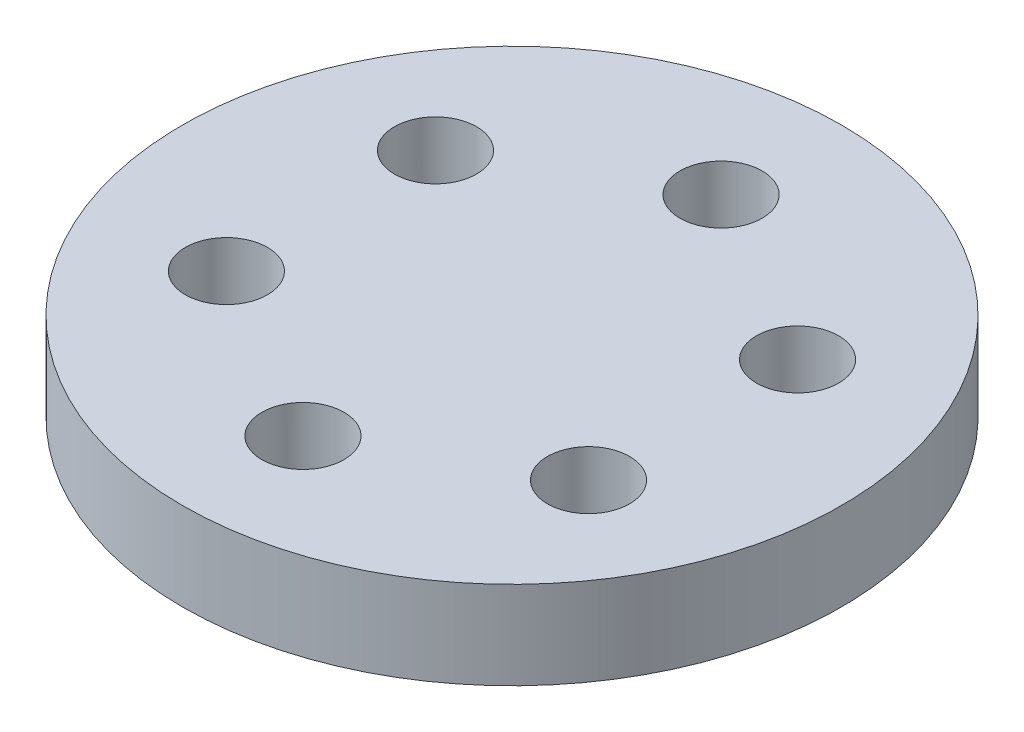
from build123d import *

# Parameters (mm, degrees)
SKETCH2_R           = 38.1
BOSS_EXTRUDE1_DEPTH = 10.16
SKETCH3_R           = 4.74923553
CUT_EXTRUDE3_DEPTH  = 25.4
CIRPATTERN1_COUNT   = 6


with BuildPart() as part:
    # Sketch2 → Boss-Extrude1 (new body)
    with BuildSketch(Plane(origin=(0, 0, 0), x_dir=(1, 0, 0), z_dir=(0, 1, 0))):
        with Locations(Location((0, 0, 0), (0, 0, 270))):
            Circle(SKETCH2_R)
    extrude(amount=BOSS_EXTRUDE1_DEPTH)

    # Sketch3 → Cut-Extrude3 (cut)
    with BuildSketch(Plane(origin=(0, 10.16, 0), x_dir=(1, 0, 0), z_dir=(0, 1, 0))):
        with Locations(Location((0, 24.168809353, 0), (0, 0, 270))):
            Circle(SKETCH3_R)
    cut_extrude3 = extrude(amount=-CUT_EXTRUDE3_DEPTH, mode=Mode.SUBTRACT)

    # CirPattern1: Cut-Extrude3 ×6 about axis
    cirpattern1_axis = Axis((0, 0, 0), (0, 1, 0))
    for i in range(1, CIRPATTERN1_COUNT):
        add(cut_extrude3.rotate(cirpattern1_axis, i * 360 / CIRPATTERN1_COUNT), mode=Mode.SUBTRACT)


solid = part.part
